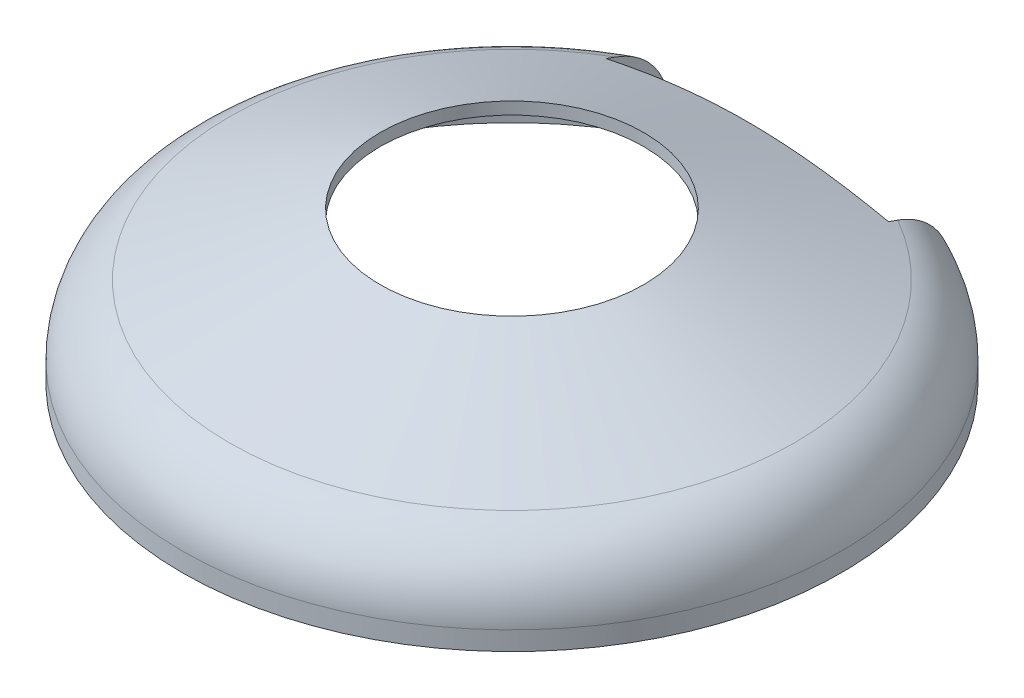
from build123d import *

# Parameters (mm, degrees)
SHELL1_T           = -3
SKETCH2_R          = 35
CUT_EXTRUDE1_DEPTH = 131.048068171
SKETCH3_W          = 75
SKETCH3_H          = 50
CUT_EXTRUDE2_DEPTH = 131.048068171


with BuildPart() as part:
    # Sketch1 → Revolve1 (revolve)
    with BuildSketch(Plane.XY, mode=Mode.PRIVATE) as revolve1_sk:
        with BuildLine():
            Line((0, 40), (0, 0))
            Line((0, 0), (-87.5, 0))
            Line((-87.5, 0), (-87.5, 5))
            ThreePointArc((-87.5, 5), (-84.085301316, 16.215125476), (-75, 23.624343151))
            Line((-75, 23.624343151), (-35, 40))
            Line((-35, 40), (0, 40))
        make_face()
    revolve(revolve1_sk.sketch.rotate(Axis((0, 40, 0), (0, -1, 0)), 270), axis=Axis((0, 40, 0), (0, -1, 0)))

    # Shell1
    shell1_openings = [part.faces().sort_by_distance(p)[0] for p in [
        (0, 0, 0),
        (0, 40, 0),
    ]]
    offset(amount=SHELL1_T, openings=shell1_openings, kind=Kind.INTERSECTION)

    # Sketch2 → Cut-Extrude1 (cut, through all)
    with BuildSketch(Plane(origin=(0, 40, 0), x_dir=(1, 0, 0), z_dir=(0, 1, 0))):
        with Locations(Location((0, 0, 0), (0, 0, 180))):
            Circle(SKETCH2_R)
    extrude(amount=-CUT_EXTRUDE1_DEPTH, mode=Mode.SUBTRACT)

    # Sketch3 → Cut-Extrude2 (cut, through all)
    with BuildSketch(Plane(origin=(0, 0, 0), x_dir=(1, 0, 0), z_dir=(0, 1, 0))):
        with Locations((0, 87.5)):
            Rectangle(SKETCH3_W, SKETCH3_H)
    extrude(amount=CUT_EXTRUDE2_DEPTH, mode=Mode.SUBTRACT)


solid = part.part
